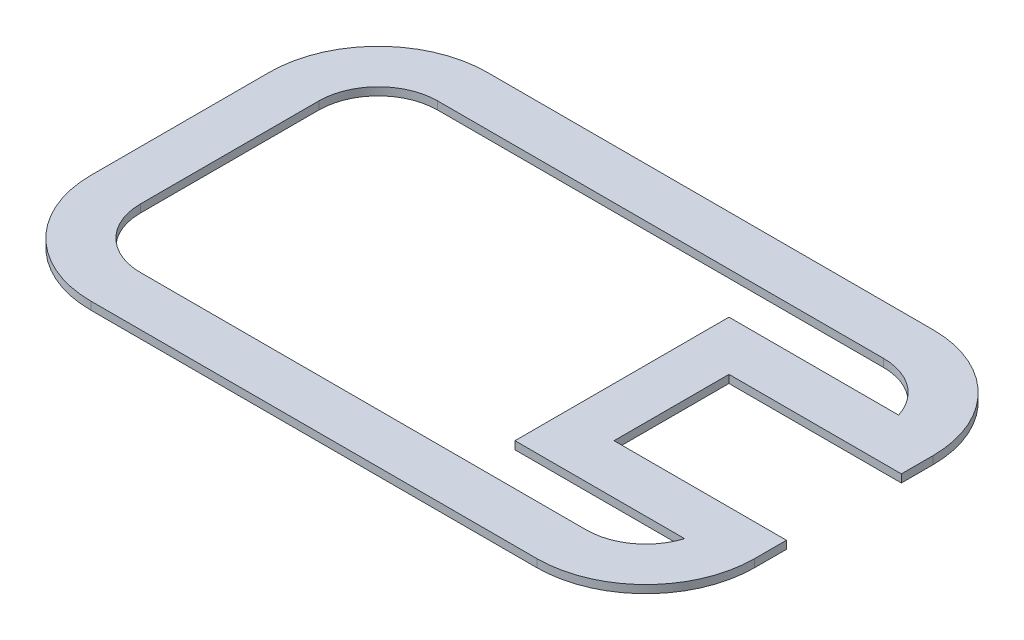
from build123d import *

# Parameters (mm, degrees)
BOSS_EXTRUDE1_DEPTH = 4


with BuildPart() as part:
    # Sketch1 → Boss-Extrude1 (new body)
    with BuildSketch(Plane(origin=(0, 0, 0), x_dir=(1, 0, 0), z_dir=(0, 1, 0))):
        with BuildLine():
            Line((55, 0), (280, 0))
            ThreePointArc((280, 0), (318.890872965, 16.109127035), (335, 55))
            Line((335, 55), (335, 71))
            Line((335, 71), (248, 71))
            Line((248, 71), (248, 129))
            Line((248, 129), (335, 129))
            Line((335, 129), (335, 145))
            ThreePointArc((335, 145), (318.890872965, 183.890872965), (280, 200))
            Line((280, 200), (55, 200))
            ThreePointArc((55, 200), (16.109127035, 183.890872965), (0, 145))
            Line((0, 145), (0, 55))
            ThreePointArc((0, 55), (16.109127035, 16.109127035), (55, 0))
        make_face()
        with BuildLine():
            Line((55, 25), (280, 25))
            ThreePointArc((280, 25), (297.748239349, 30.813226755), (308.618176043, 46))
            Line((308.618176043, 46), (223, 46))
            Line((223, 46), (223, 154))
            Line((223, 154), (308.618176043, 154))
            ThreePointArc((308.618176043, 154), (297.748239349, 169.186773245), (280, 175))
            Line((280, 175), (55, 175))
            ThreePointArc((55, 175), (33.786796564, 166.213203436), (25, 145))
            Line((25, 145), (25, 55))
            ThreePointArc((25, 55), (33.786796564, 33.786796564), (55, 25))
        make_face(mode=Mode.SUBTRACT)
    extrude(amount=BOSS_EXTRUDE1_DEPTH)


solid = part.part
